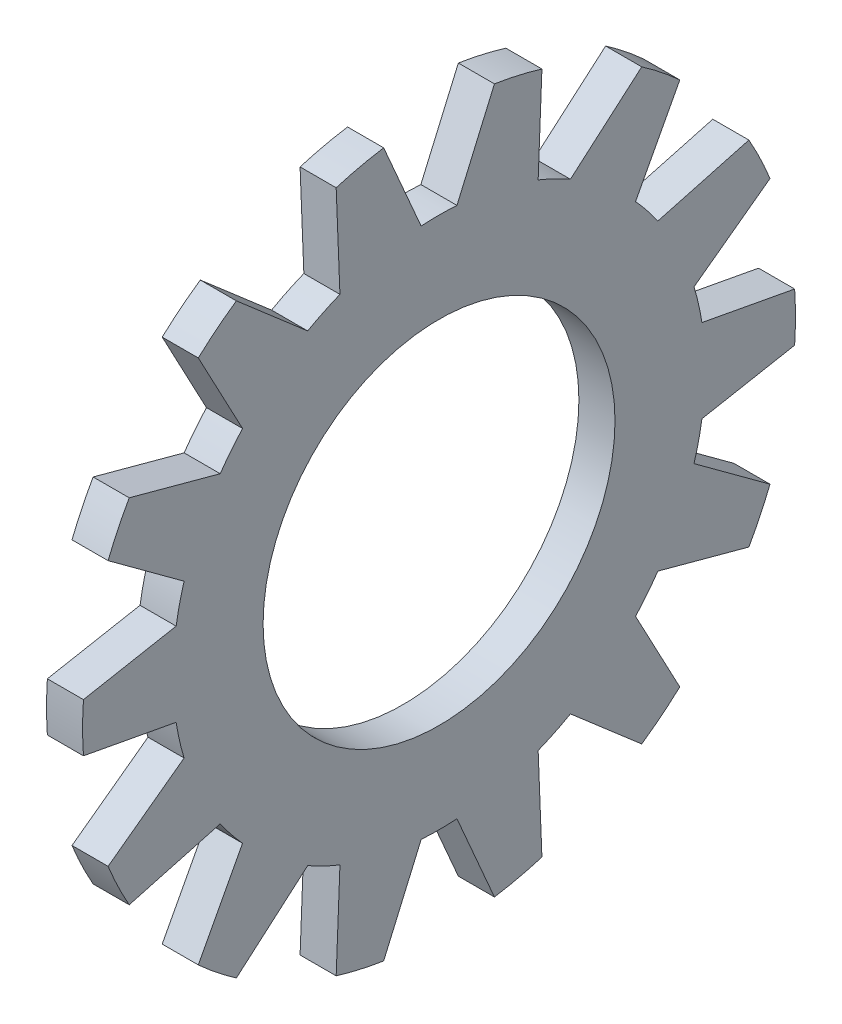
from build123d import *

# Parameters (mm, degrees)
SECSKE_W      = 0.508
SECSKE_H      = 2.54
EXTCUT_DEPTH  = 8.112566942
EXTCUTS_COUNT = 14
EXTCUTS_ANGLE = 334.285714286


with BuildPart() as part:
    # SecSke → Body (revolve)
    with BuildSketch(Plane.XY, mode=Mode.PRIVATE) as body_sk:
        with Locations((-0.254, 3.7465)):
            Rectangle(SECSKE_W, SECSKE_H)
    revolve(body_sk.sketch.rotate(Axis((-34.925, 0, 0), (1, 0, 0)), 90), axis=Axis((-34.925, 0, 0), (1, 0, 0)))

    # ExtCutSke → ExtCut (cut, through all)
    with BuildSketch(Plane(origin=(0, 0, 0), x_dir=(0, 0, -1), z_dir=(1, 0, 0))):
        with BuildLine():
            Line((-0.882309718, 5.192903063), (-0.25202333, 3.738013709))
            ThreePointArc((-0.25202333, 3.738013709), (0, 3.7465), (0.25202333, 3.738013709))
            Line((0.25202333, 3.738013709), (0.882309718, 5.192903063))
            ThreePointArc((0.882309718, 5.192903063), (0, 5.267325), (-0.882309718, 5.192903063))
        make_face()
    extcut = extrude(amount=-EXTCUT_DEPTH, mode=Mode.SUBTRACT)

    # ExtCuts: ExtCut ×14 about axis
    extcuts_axis = Axis((-34.925, 0, 0), (1, 0, 0))
    for i in range(1, EXTCUTS_COUNT):
        add(extcut.rotate(extcuts_axis, i * EXTCUTS_ANGLE / (EXTCUTS_COUNT - 1)), mode=Mode.SUBTRACT)


solid = part.part
